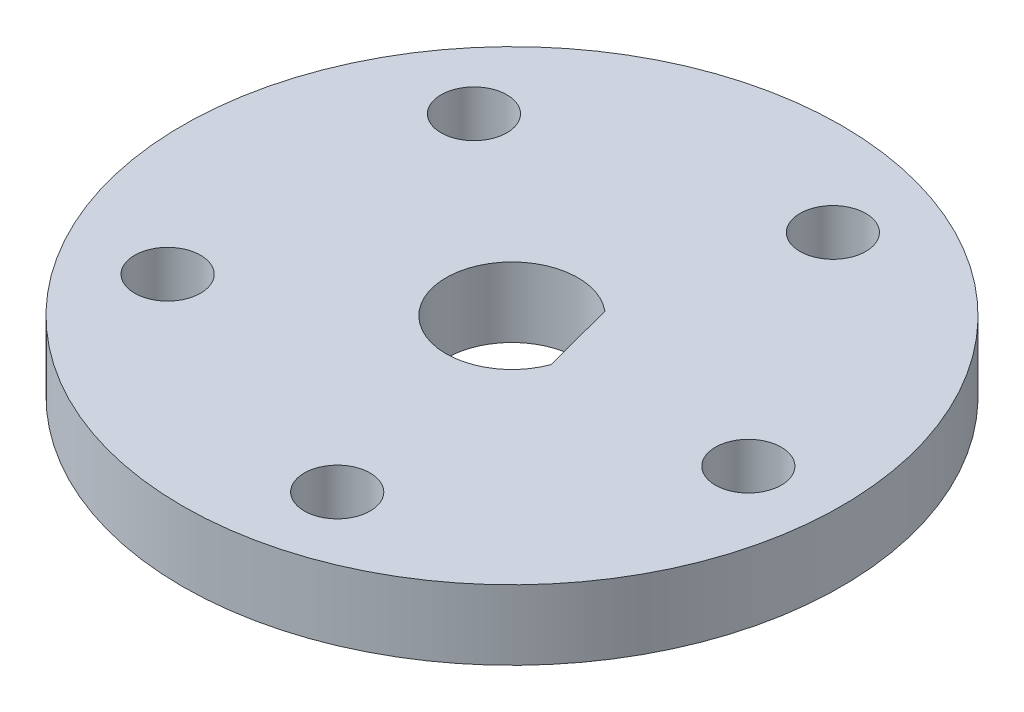
from build123d import *

# Parameters (mm, degrees)
SKETCH1_R           = 15
SKETCH1_R_2         = 1.5
BOSS_EXTRUDE1_DEPTH = 3.175
CUT_EXTRUDE1_DEPTH  = 3.175


with BuildPart() as part:
    # Sketch1 → Boss-Extrude1 (new body)
    with BuildSketch(Plane(origin=(0, 0, 0), x_dir=(1, 0, 0), z_dir=(0, 1, 0))):
        with Locations(Location((0, 0, 0), (0, 0, 270))):
            Circle(SKETCH1_R)
        with Locations(Location((-8.825381331, 7.093668739, 0), (0, 0, 270))):
            Circle(SKETCH1_R_2, mode=Mode.SUBTRACT)
        with Locations(Location((4.019287066, 10.585500617, 0), (0, 0, 270))):
            Circle(SKETCH1_R_2, mode=Mode.SUBTRACT)
        with Locations(Location((11.309437348, -0.55146957, 0), (0, 0, 270))):
            Circle(SKETCH1_R_2, mode=Mode.SUBTRACT)
        with Locations(Location((2.970329609, -10.926327555, 0), (0, 0, 270))):
            Circle(SKETCH1_R_2, mode=Mode.SUBTRACT)
        with Locations(Location((-9.473672692, -6.201372231, 0), (0, 0, 270))):
            Circle(SKETCH1_R_2, mode=Mode.SUBTRACT)
    extrude(amount=BOSS_EXTRUDE1_DEPTH)

    # Sketch2 → Cut-Extrude1 (cut)
    with BuildSketch(Plane(origin=(0, 3.175, 0), x_dir=(1, 0, 0), z_dir=(0, 1, 0))):
        with BuildLine():
            Line((2.818653923, -1.027224446), (1.934730022, 2.292775554))
            ThreePointArc((1.934730022, 2.292775554), (-2.899010992, -0.771838887), (2.818653923, -1.027224446))
        make_face()
    extrude(amount=-CUT_EXTRUDE1_DEPTH, mode=Mode.SUBTRACT)


solid = part.part
